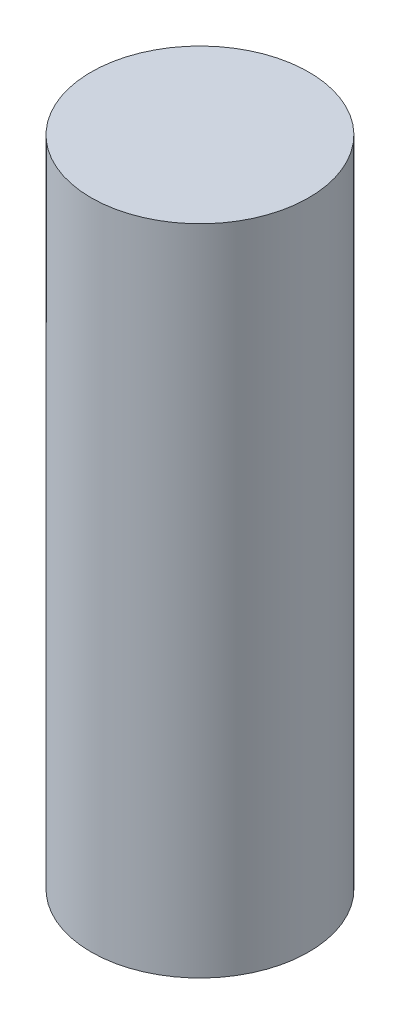
from build123d import *

# Parameters (mm, degrees)
SKETCH_1_R      = 5
EXTRUDE_1_DEPTH = 30


with BuildPart() as part:
    # 스케치1 → 보스-돌출1 (new body)
    with BuildSketch(Plane(origin=(0, 0, 0), x_dir=(1, 0, 0), z_dir=(0, 1, 0))):
        with Locations(Location((0, 0, 0), (0, 0, 270))):
            Circle(SKETCH_1_R)
    extrude(amount=EXTRUDE_1_DEPTH)


solid = part.part
